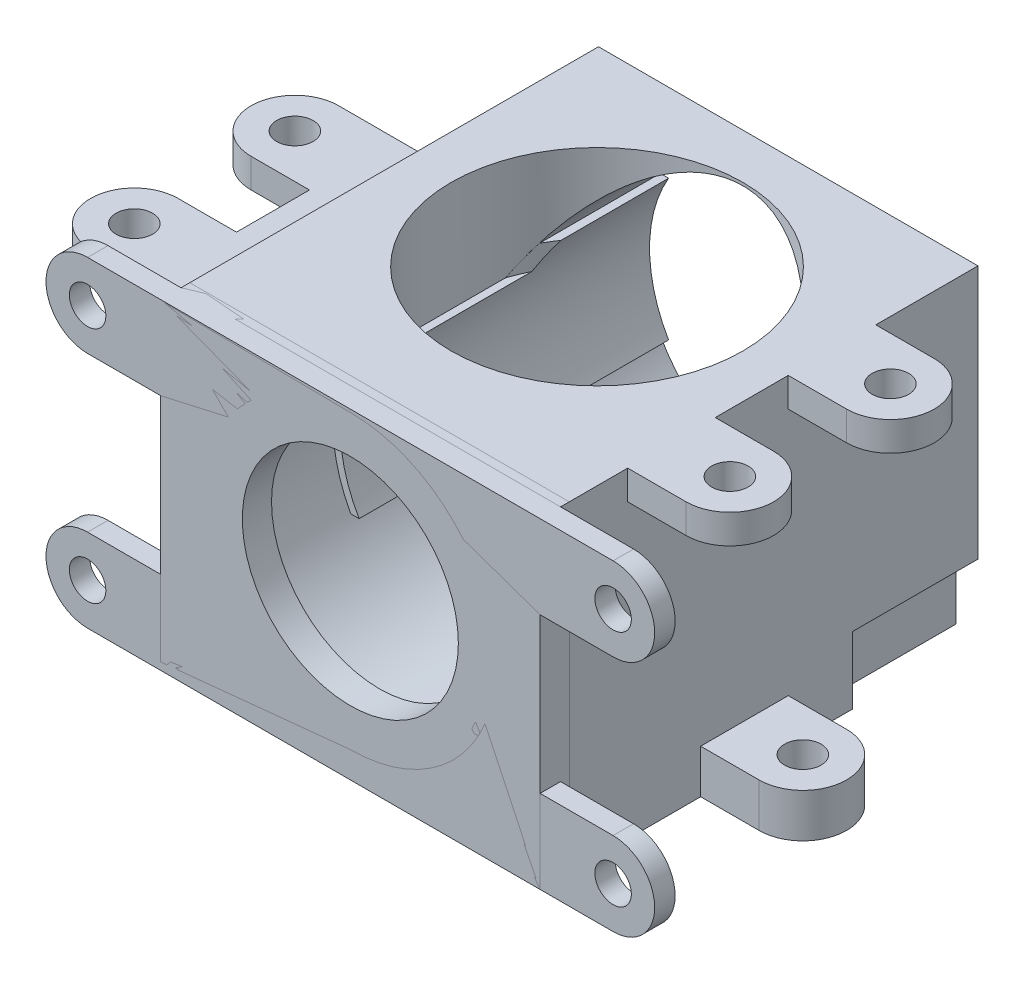
from build123d import *

# Parameters (mm, degrees)
SKETCH1_W             = 33.02
SKETCH1_H             = 27.94
BOSS_EXTRUDE1_DEPTH   = 38.1
SKETCH4_R             = 12.7
CUT_EXTRUDE3_DEPTH    = 14.224
SKETCH3_R             = 5.715
CUT_EXTRUDE4_DEPTH    = 2.032
SKETCH7_R             = 1.5875
BOSS_EXTRUDE2_DEPTH   = 2.54
SKETCH9_R             = 1.5875
BOSS_EXTRUDE4_DEPTH   = 9.398
SKETCH11_W            = 23.926877617
SKETCH11_H            = 6.858
CUT_EXTRUDE7_DEPTH    = 64.156168968
SKETCH12_W            = 1.905
SKETCH12_H            = 5.842
CUT_EXTRUDE8_DEPTH    = 10.922
SKETCH2_R             = 12.7
CUT_EXTRUDE12_DEPTH   = 64.156168968
BOSS_EXTRUDE8_DEPTH   = 38.1
BOSS_EXTRUDE8_2_DEPTH = 38.1
SKETCH15_R            = 1.5875
BOSS_EXTRUDE9_DEPTH   = 3.81
SKETCH16_R            = 1.5875
BOSS_EXTRUDE10_DEPTH  = 1.778
SKETCH17_R            = 12.7
CUT_EXTRUDE13_DEPTH   = 8.89
SKETCH22_W            = 2.54
SKETCH22_H            = 27.94
BOSS_EXTRUDE24_DEPTH  = 33.02
SKETCH23_R            = 9.398
CUT_EXTRUDE14_DEPTH   = 8.636
SKETCH24_R            = 12.7
CUT_EXTRUDE15_DEPTH   = 8.636


with BuildPart() as part:
    # Sketch1 → Boss-Extrude1 (new body)
    with BuildSketch(Plane.XY):
        with Locations((16.51, 13.97)):
            Rectangle(SKETCH1_W, SKETCH1_H)
    extrude(amount=BOSS_EXTRUDE1_DEPTH)

    # Sketch4 → Cut-Extrude3 (cut)
    with BuildSketch(Plane(origin=(0, 27.94, 0), x_dir=(1, 0, 0), z_dir=(0, 1, 0))):
        with Locations(Location((16.51, -16.637, 0), (0, 0, 270))):
            Circle(SKETCH4_R)
    extrude(amount=-CUT_EXTRUDE3_DEPTH, mode=Mode.SUBTRACT)

    # Sketch3 → Cut-Extrude4 (cut)
    with BuildSketch(Plane(origin=(0, 3.81, 0), x_dir=(-1, 0, 0), z_dir=(0, -1, 0))):
        with Locations(Location((-16.51, -14.986, 0), (0, 0, 90))):
            Circle(SKETCH3_R)
    extrude(amount=CUT_EXTRUDE4_DEPTH, mode=Mode.SUBTRACT)

    # Sketch7 → Boss-Extrude2 (add)
    # profile 1 of 2: a face of its own
    with BuildSketch(Plane(origin=(0, 27.94, 0), x_dir=(1, 0, 0), z_dir=(0, 1, 0))):
        with BuildLine():
            Line((33.02, -8.89), (38.099999746, -8.89))
            ThreePointArc((38.099999746, -8.89), (41.909999746, -12.7), (38.099999746, -16.51))
            Line((38.099999746, -16.51), (33.02, -16.51))
            Line((33.02, -16.51), (33.02, -8.89))
        make_face()
        with Locations(Location((38.099999746, -12.7, 0), (0, 0, 270))):
            Circle(SKETCH7_R, mode=Mode.SUBTRACT)
    # profile 2 of 2: a face of its own
    with BuildSketch(Plane(origin=(0, 27.94, 0), x_dir=(1, 0, 0), z_dir=(0, 1, 0))):
        with BuildLine():
            Line((33.02, -22.86), (38.0999746, -22.86))
            ThreePointArc((38.0999746, -22.86), (41.9099746, -26.67), (38.0999746, -30.48))
            Line((38.0999746, -30.48), (33.02, -30.48))
            Line((33.02, -30.48), (33.02, -22.86))
        make_face()
        with Locations(Location((38.0999746, -26.67, 0), (0, 0, 270))):
            Circle(SKETCH7_R, mode=Mode.SUBTRACT)
    extrude(amount=-BOSS_EXTRUDE2_DEPTH)

    # Sketch9 → Boss-Extrude4 (add)
    with BuildSketch(Plane(origin=(0, 27.94, 0), x_dir=(1, 0, 0), z_dir=(0, 1, 0))):
        with BuildLine():
            Line((-13.716, -8.89), (0, -8.89))
            Line((0, -8.89), (0, -30.48))
            Line((0, -30.48), (-13.716, -30.48))
            ThreePointArc((-13.716, -30.48), (-17.526, -26.67), (-13.716, -22.86))
            Line((-13.716, -22.86), (-8.6360254, -22.86))
            Line((-8.6360254, -22.86), (-8.6360254, -16.51))
            Line((-8.6360254, -16.51), (-13.716, -16.51))
            ThreePointArc((-13.716, -16.51), (-17.526, -12.7), (-13.716, -8.89))
        make_face()
        with Locations(Location((-13.716, -26.67, 0), (0, 0, 270))):
            Circle(SKETCH9_R, mode=Mode.SUBTRACT)
        with Locations(Location((-13.716, -12.7, 0), (0, 0, 270))):
            Circle(SKETCH9_R, mode=Mode.SUBTRACT)
    extrude(amount=-BOSS_EXTRUDE4_DEPTH)

    # Sketch11 → Cut-Extrude7 (cut, through all)
    with BuildSketch(Plane.XY.offset(38.1)):
        with Locations((-11.963438809, 24.511)):
            Rectangle(SKETCH11_W, SKETCH11_H)
    extrude(amount=-CUT_EXTRUDE7_DEPTH, mode=Mode.SUBTRACT)

    # Sketch12 → Cut-Extrude8 (cut)
    with BuildSketch(Plane(origin=(0, 0, 0), x_dir=(-1, 0, 0), z_dir=(0, 0, -1))):
        with Locations((-32.0675, 2.921)):
            Rectangle(SKETCH12_W, SKETCH12_H)
        with Locations((-0.9525, 2.921)):
            Rectangle(SKETCH12_W, SKETCH12_H)
    extrude(amount=-CUT_EXTRUDE8_DEPTH, mode=Mode.SUBTRACT)

    # Sketch2 → Cut-Extrude12 (cut, through all)
    with BuildSketch(Plane.XY.offset(38.1)):
        with Locations((16.51, 14.986)):
            Circle(SKETCH2_R)
    extrude(amount=-CUT_EXTRUDE12_DEPTH, mode=Mode.SUBTRACT)

    # Sketch15 → Boss-Extrude9 (add)
    # profile 1 of 2: a face of its own
    with BuildSketch(Plane.XZ):
        with BuildLine():
            Line((0, 24.13), (-5.079999746, 24.13))
            ThreePointArc((-5.079999746, 24.13), (-8.889999746, 20.32), (-5.079999746, 16.51))
            Line((-5.079999746, 16.51), (0, 16.51))
            Line((0, 16.51), (0, 24.13))
        make_face()
        with Locations(Location((-5.079999746, 20.32, 0), (0, 0, 270))):
            Circle(SKETCH15_R, mode=Mode.SUBTRACT)
    # profile 2 of 2: a face of its own
    with BuildSketch(Plane.XZ):
        with BuildLine():
            Line((33.02, 16.51), (33.02, 24.13))
            Line((33.02, 24.13), (38.099999746, 24.13))
            ThreePointArc((38.099999746, 24.13), (41.909999746, 20.32), (38.099999746, 16.51))
            Line((38.099999746, 16.51), (33.02, 16.51))
        make_face()
        with Locations(Location((38.099999746, 20.32, 0), (0, 0, 270))):
            Circle(SKETCH15_R, mode=Mode.SUBTRACT)
    extrude(amount=-BOSS_EXTRUDE9_DEPTH)

    # Sketch16 → Boss-Extrude10 (add)
    # profile 1 of 4: a face of its own
    with BuildSketch(Plane.XY.offset(38.1)):
        with BuildLine():
            Line((-6.35, 27.94), (0, 27.94))
            Line((0, 27.94), (0, 20.701))
            Line((0, 20.701), (-6.35, 20.701))
            ThreePointArc((-6.35, 20.701), (-9.9695, 24.3205), (-6.35, 27.94))
        make_face()
        with Locations((-6.35, 24.3205)):
            Circle(SKETCH16_R, mode=Mode.SUBTRACT)
    # profile 2 of 4: a face of its own
    with BuildSketch(Plane.XY.offset(38.1)):
        with BuildLine():
            Line((-6.35, 7.239), (0, 7.239))
            Line((0, 7.239), (0, 0))
            Line((0, 0), (-6.35, 0))
            ThreePointArc((-6.35, 0), (-9.9695, 3.6195), (-6.35, 7.239))
        make_face()
        with Locations((-6.35, 3.6195)):
            Circle(SKETCH16_R, mode=Mode.SUBTRACT)
    # profile 3 of 4: a face of its own
    with BuildSketch(Plane.XY.offset(38.1)):
        with BuildLine():
            Line((33.02, 0), (39.37, 0))
            ThreePointArc((39.37, 0), (42.9895, 3.6195), (39.37, 7.239))
            Line((39.37, 7.239), (33.02, 7.239))
            Line((33.02, 7.239), (33.02, 0))
        make_face()
        with Locations(Location((39.37, 3.6195, 0), (0, 0, 180))):
            Circle(SKETCH16_R, mode=Mode.SUBTRACT)
    # profile 4 of 4: a face of its own
    with BuildSketch(Plane.XY.offset(38.1)):
        with BuildLine():
            Line((33.02, 20.701), (39.37, 20.701))
            ThreePointArc((39.37, 20.701), (42.9895, 24.3205), (39.37, 27.94))
            Line((39.37, 27.94), (33.02, 27.94))
            Line((33.02, 27.94), (33.02, 20.701))
        make_face()
        with Locations(Location((39.37, 24.3205, 0), (0, 0, 180))):
            Circle(SKETCH16_R, mode=Mode.SUBTRACT)
    extrude(amount=-BOSS_EXTRUDE10_DEPTH)


with BuildPart() as body_2:
    # Sketch14 → Boss-Extrude8 (new, through all)
    with BuildSketch(Plane.XY.offset(38.1)):
        with BuildLine():
            Line((5.368690203, 21.082), (6.09832343, 21.082))
            ThreePointArc((6.09832343, 21.082), (4.445, 14.986), (6.09832343, 8.89))
            Line((6.09832343, 8.89), (5.368690203, 8.89))
            ThreePointArc((5.368690203, 8.89), (3.81, 14.986), (5.368690203, 21.082))
        make_face()
    extrude(amount=-BOSS_EXTRUDE8_DEPTH)


with BuildPart() as body_3:
    # Sketch14 → Boss-Extrude8 2 (new, through all)
    with BuildSketch(Plane.XY.offset(38.1)):
        with BuildLine():
            Line((26.92167657, 8.89), (27.651309797, 8.89))
            ThreePointArc((27.651309797, 8.89), (29.21, 14.986), (27.651309797, 21.082))
            Line((27.651309797, 21.082), (26.92167657, 21.082))
            ThreePointArc((26.92167657, 21.082), (28.575, 14.986), (26.92167657, 8.89))
        make_face()
    extrude(amount=-BOSS_EXTRUDE8_2_DEPTH)


with BuildPart() as cut_extrude13_tool:
    # Sketch17 → Cut-Extrude13 (new body)
    with BuildSketch(Plane(origin=(0, 27.94, 0), x_dir=(1, 0, 0), z_dir=(0, 1, 0))):
        with Locations(Location((16.51, -16.637, 0), (0, 0, 270))):
            Circle(SKETCH17_R)
    extrude(amount=-CUT_EXTRUDE13_DEPTH)


with BuildPart() as body_2_1:
    add(body_2.part)

    # Cut-Extrude13: cut by cut_extrude13_tool
    add(cut_extrude13_tool.part, mode=Mode.SUBTRACT)


with BuildPart() as body_3_1:
    add(body_3.part)

    # Cut-Extrude13: cut by cut_extrude13_tool
    add(cut_extrude13_tool.part, mode=Mode.SUBTRACT)


with BuildPart() as body_4:
    # Sketch22 → Boss-Extrude24 (new body)
    with BuildSketch(Plane(origin=(33.02, 0, 0), x_dir=(0, 0, -1), z_dir=(1, 0, 0))):
        with Locations((-36.83, 13.97)):
            Rectangle(SKETCH22_W, SKETCH22_H)
    extrude(amount=-BOSS_EXTRUDE24_DEPTH)

    # Sketch23 → Cut-Extrude14 (cut)
    with BuildSketch(Plane.XY.offset(38.1)):
        with Locations((16.51, 14.986)):
            Circle(SKETCH23_R)
    extrude(amount=-CUT_EXTRUDE14_DEPTH, mode=Mode.SUBTRACT)


with BuildPart() as cut_extrude15_tool:
    # Sketch24 → Cut-Extrude15 (new body)
    with BuildSketch(Plane(origin=(0, 0, 35.56), x_dir=(-1, 0, 0), z_dir=(0, 0, -1))):
        with Locations(Location((-16.51, 14.986, 0), (0, 0, 180))):
            Circle(SKETCH24_R)
    extrude(amount=CUT_EXTRUDE15_DEPTH)


with BuildPart() as body_2_2:
    add(body_2_1.part)

    # Cut-Extrude15: cut by cut_extrude15_tool
    add(cut_extrude15_tool.part, mode=Mode.SUBTRACT)


with BuildPart() as body_3_2:
    add(body_3_1.part)

    # Cut-Extrude15: cut by cut_extrude15_tool
    add(cut_extrude15_tool.part, mode=Mode.SUBTRACT)


with BuildPart() as cut_extrude15_piece_1:
    # of the separate pieces the step leaves, piece 1, a body of its own (cut_extrude15_pieces)
    add(body_2_2.part.solids().sort_by_distance((6.09832343, 8.89, 26.924))[0])


with BuildPart() as cut_extrude15_piece_2:
    # of the separate pieces the step leaves, piece 2, a body of its own (cut_extrude15_pieces)
    add(body_2_2.part.solids().sort_by_distance((6.09832343, 8.89, 38.1))[0])


with BuildPart() as cut_extrude15_piece_1_of_body_3:
    # of the separate pieces the step leaves, piece 1, a body of its own (cut_extrude15_pieces_of_body_3)
    add(body_3_2.part.solids().sort_by_distance((26.92167657, 8.89, 26.924))[0])


with BuildPart() as cut_extrude15_piece_2_of_body_3:
    # of the separate pieces the step leaves, piece 2, a body of its own (cut_extrude15_pieces_of_body_3)
    add(body_3_2.part.solids().sort_by_distance((26.92167657, 8.89, 38.1))[0])


solid = Compound([part.part, body_4.part, cut_extrude15_piece_1.part, cut_extrude15_piece_2.part, cut_extrude15_piece_1_of_body_3.part, cut_extrude15_piece_2_of_body_3.part])
